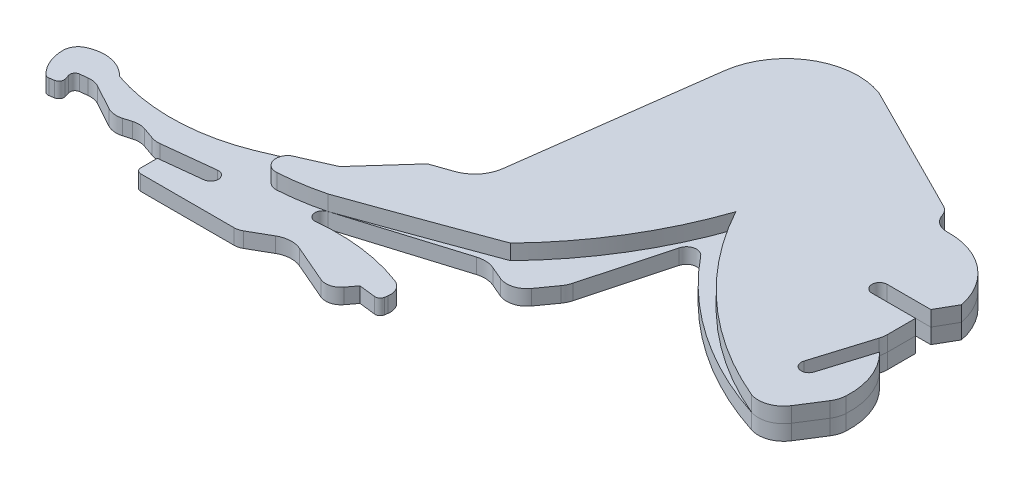
from build123d import *

# Parameters (mm, degrees)
BOSS_EXTRUDE1_DEPTH = 3
FILLET1_R           = 3
FILLET2_R           = 5
FILLET3_R           = 4
FILLET4_R           = 1
FILLET5_R           = 10
FILLET6_R           = 2
BOSS_EXTRUDE2_DEPTH = 3


with BuildPart() as part:
    # Sketch2 → Boss-Extrude1 (new body)
    with BuildSketch(Plane(origin=(0, 0, 0), x_dir=(1, 0, 0), z_dir=(0, 1, 0))):
        with BuildLine():
            Line((104.861742338, 51.61), (96.285742338, 51.61))
            ThreePointArc((96.285742338, 51.61), (94.785742338, 50.11), (96.285742338, 48.61))
            Line((96.285742338, 48.61), (104.861742338, 48.61))
            Line((104.861742338, 48.61), (104.861742338, 42.36))
            Line((104.861742338, 42.36), (101.159535482, 30.341590159))
            ThreePointArc((101.159535482, 30.341590159), (102.15147179, 28.466473533), (104.026588416, 29.458409841))
            Line((104.026588416, 29.458409841), (107.0705594, 39.34))
            ThreePointArc((107.0705594, 39.34), (110.559148386, 33.719570051), (111.09, 27.125809175))
            Line((111.09, 27.125809175), (105.531161353, 18.360668643))
            ThreePointArc((105.531161353, 18.360668643), (84.319857644, 28.006827284), (67.651742338, 44.29))
            Line((67.651742338, 44.29), (61.935762488, 23.027584397))
            Line((61.935762488, 23.027584397), (57.13, 16.32))
            Line((57.13, 16.32), (49.95, 19.39))
            Line((49.95, 19.39), (25.830040494, 11.99))
            ThreePointArc((25.830040494, 11.99), (24.800734775, 10.253880031), (26.431506195, 9.064692331))
            ThreePointArc((26.431506195, 9.064692331), (36.664028635, 8.803570476), (46.46571567, 5.854056721))
            Line((46.46571567, 5.854056721), (45.9, 1.991540554))
            Line((45.9, 1.991540554), (41.660045255, 2.482673431))
            Line((41.660045255, 2.482673431), (38.9, -1.2))
            Line((38.9, -1.2), (27.015518097, 3.924692331))
            Line((27.015518097, 3.924692331), (20.16, 0))
            Line((20.16, 0), (0, 0))
            Line((0, 0), (0, 4.28))
            Line((0, 4.28), (8.255364291, 5.2))
            ThreePointArc((8.255364291, 5.2), (9.58, 6.856906829), (7.923093171, 8.181542538))
            Line((7.923093171, 8.181542538), (-3.121398875, 6.950714639))
            Line((-3.121398875, 6.950714639), (-7.499203077, 8.482641989))
            Line((-7.499203077, 8.482641989), (-11.827625236, 7.22158903))
            Line((-11.827625236, 7.22158903), (-19.255161489, 11.297641869))
            Line((-19.255161489, 11.297641869), (-23.205269456, 10.857431213))
            Line((-23.205269456, 10.857431213), (-22.269740859, 7.646334739))
            Line((-22.269740859, 7.646334739), (-24.812537217, 7.22158903))
            ThreePointArc((-24.812537217, 7.22158903), (-27.256062178, 10.796585791), (-27.5, 15.12))
            ThreePointArc((-27.5, 15.12), (-22.484233626, 16.792009689), (-17.704912147, 14.531121607))
            ThreePointArc((-17.704912147, 14.531121607), (-4.702395419, 12.521774189), (8.186937419, 15.161474421))
            Line((8.186937419, 15.161474421), (21.991482078, 21.019847276))
            Line((21.991482078, 21.019847276), (29.148159429, 28.986869108))
            Line((29.148159429, 28.986869108), (36.03, 31.378427725))
            Line((36.03, 31.378427725), (41.652863678, 73.662098134))
            ThreePointArc((41.652863678, 73.662098134), (47.001876481, 83.094401265), (57.4, 86.17))
            Line((57.4, 86.17), (89.772823478, 69.836247096))
            ThreePointArc((89.772823478, 69.836247096), (90.799785464, 67.40403524), (93.25912827, 66.443859006))
            ThreePointArc((93.25912827, 66.443859006), (102.166931279, 63.469413825), (107.0705594, 55.46))
            Line((107.0705594, 55.46), (104.861742338, 51.61))
        make_face()
    extrude(amount=BOSS_EXTRUDE1_DEPTH)

    # Fillet1
    fillet1_edges = [part.edges().sort_by_distance(p)[0] for p in [
        (46.46571567, 1.5, -5.854056721),
        (38.9, 1.5, 1.2),
        (20.16, 1.5, 0),
        (-27.5, 1.5, -15.12),
        (29.148159429, 1.5, -28.986869108),
        (89.772823478, 1.5, -69.836247096),
    ]]
    fillet(fillet1_edges, radius=FILLET1_R)

    # Fillet2
    fillet2_edges = [part.edges().sort_by_distance(p)[0] for p in [
        (104.861742338, 1.5, -42.36),
        (111.09, 1.5, -27.125809175),
        (105.531161353, 1.5, -18.360668643),
        (61.935762488, 1.5, -23.027584397),
        (49.95, 1.5, -19.39),
        (27.015518097, 1.5, -3.924692331),
    ]]
    fillet(fillet2_edges, radius=FILLET2_R)

    # Fillet3
    fillet3_edges = [part.edges().sort_by_distance(p)[0] for p in [
        (57.13, 1.5, -16.32),
        (-3.121398875, 1.5, -6.950714639),
        (-7.499203077, 1.5, -8.482641989),
        (-11.827625236, 1.5, -7.22158903),
        (-19.255161489, 1.5, -11.297641869),
        (36.03, 1.5, -31.378427725),
    ]]
    fillet(fillet3_edges, radius=FILLET3_R)

    # Fillet4
    fillet4_edges = [part.edges().sort_by_distance(p)[0] for p in [
        (45.9, 1.5, -1.991540554),
        (0, 1.5, 0),
        (-23.205269456, 1.5, -10.857431213),
        (-22.269740859, 1.5, -7.646334739),
        (-24.812537217, 1.5, -7.22158903),
    ]]
    fillet(fillet4_edges, radius=FILLET4_R)

    # Fillet5
    fillet5_edges = [part.edges().sort_by_distance(p)[0] for p in [
        (57.4, 1.5, -86.17),
    ]]
    fillet(fillet5_edges, radius=FILLET5_R)

    # Fillet6
    fillet6_edges = [part.edges().sort_by_distance(p)[0] for p in [
        (67.651742338, 1.5, -44.29),
    ]]
    fillet(fillet6_edges, radius=FILLET6_R)


with BuildPart() as body_2:
    # Sketch3 → Boss-Extrude2 (new body)
    with BuildSketch(Plane(origin=(0, 3, 0), x_dir=(1, 0, 0), z_dir=(0, 1, 0))):
        with BuildLine():
            Line((104.861742338, 48.61), (96.285742338, 48.61))
            ThreePointArc((96.285742338, 48.61), (94.785742338, 50.11), (96.285742338, 51.61))
            Line((96.285742338, 51.61), (104.861742338, 51.61))
            Line((104.861742338, 51.61), (107.0705594, 55.46))
            ThreePointArc((107.0705594, 55.46), (102.166931279, 63.469413825), (93.25912827, 66.443859006))
            ThreePointArc((93.25912827, 66.443859006), (91.217265508, 67.058215862), (89.944912878, 68.769284731))
            ThreePointArc((89.944912878, 68.769284731), (89.368859073, 69.785382473), (88.448424673, 70.504474347))
            Line((88.448424673, 70.504474347), (62.886391144, 83.401833753))
            ThreePointArc((62.886391144, 83.401833753), (50.629889119, 82.303384138), (43.866151343, 72.023292468))
            Line((43.866151343, 72.023292468), (38.743746243, 33.50304703))
            ThreePointArc((38.743746243, 33.50304703), (37.356668761, 30.29620131), (34.493830529, 28.293203387))
            Line((34.493830529, 28.293203387), (30.525960235, 26.914299837))
            Line((30.525960235, 26.914299837), (22.34841713, 17.810820491))
            Line((22.34841713, 17.810820491), (15.773824722, 14.905675932))
            ThreePointArc((15.773824722, 14.905675932), (14.800041257, 12.21917328), (17.163927201, 10.613684575))
            ThreePointArc((17.163927201, 10.613684575), (21.529057218, 11.09988897), (25.830040494, 11.99))
            ThreePointArc((25.830040494, 11.99), (39.031835006, 16.740180215), (52.200742429, 21.580786346))
            ThreePointArc((52.200742429, 21.580786346), (62.128366101, 34.40394722), (69.014066143, 49.086532194))
            ThreePointArc((69.014066143, 49.086532194), (82.878604374, 31.477866982), (101.787139988, 19.446333753))
            ThreePointArc((101.787139988, 19.446333753), (105.019281146, 19.504746746), (107.540156963, 21.528439821))
            Line((107.540156963, 21.528439821), (110.472177565, 26.151630788))
            ThreePointArc((110.472177565, 26.151630788), (111.011310028, 27.303917414), (111.242191732, 28.554965743))
            ThreePointArc((111.242191732, 28.554965743), (110.317052398, 34.396430634), (107.0705594, 39.34))
            Line((107.0705594, 39.34), (104.026588416, 29.458409841))
            ThreePointArc((104.026588416, 29.458409841), (102.15147179, 28.466473533), (101.159535482, 30.341590159))
            Line((101.159535482, 30.341590159), (104.640163894, 41.640693745))
            ThreePointArc((104.640163894, 41.640693745), (104.806037423, 42.368385383), (104.861742338, 43.112660943))
            Line((104.861742338, 43.112660943), (104.861742338, 48.61))
        make_face()
    extrude(amount=BOSS_EXTRUDE2_DEPTH)


solid = Compound([part.part, body_2.part])
